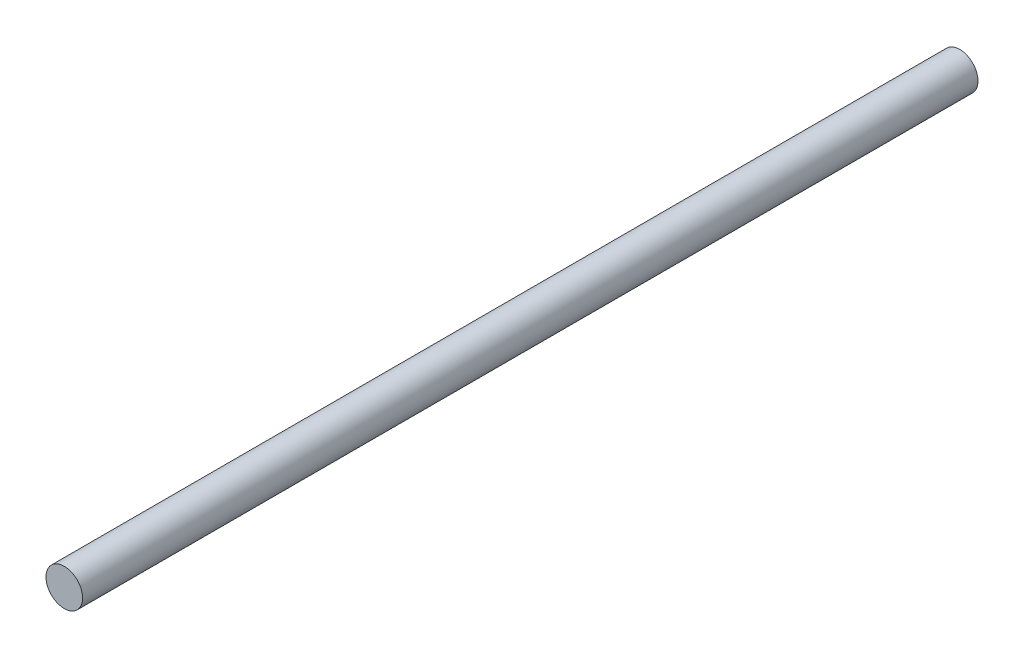
from build123d import *

# Parameters (mm, degrees)
SKETCH1_R           = 3.81
BOSS_EXTRUDE1_DEPTH = 186.182


with BuildPart() as part:
    # Sketch1 → Boss-Extrude1 (new body)
    with BuildSketch(Plane.XY):
        Circle(SKETCH1_R)
    extrude(amount=BOSS_EXTRUDE1_DEPTH)


solid = part.part
